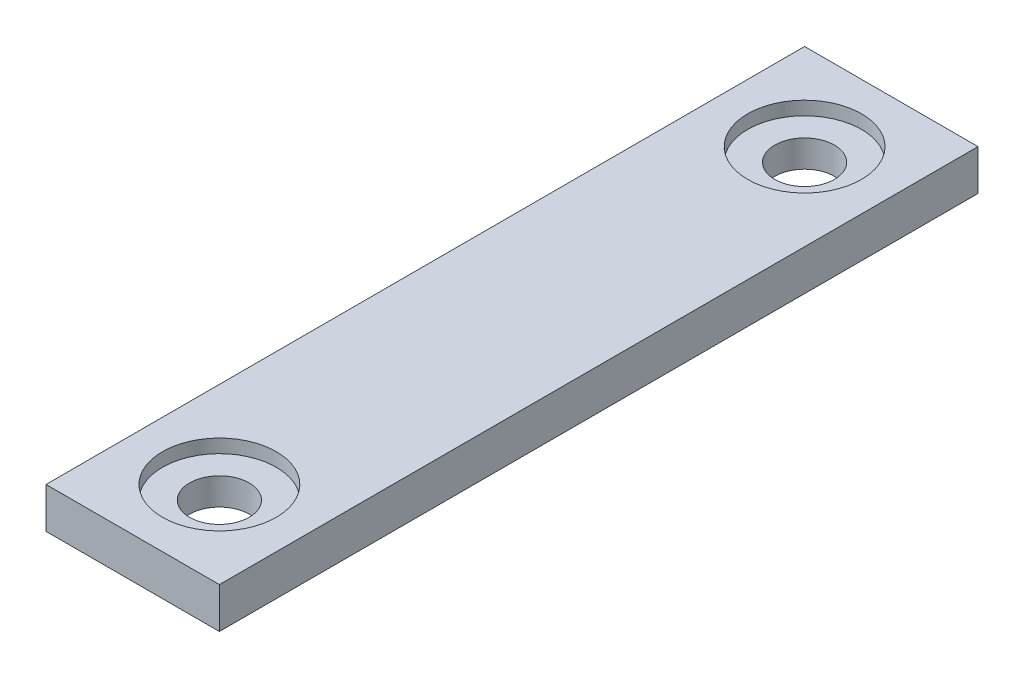
from build123d import *

# Parameters (mm, degrees)
SKETCH_1_W          = 6.4
SKETCH_1_H          = 28
EXTRUDE_1_DEPTH     = 1.5
SKETCH_2_R          = 1.1
CUT_EXTRUDE_1_DEPTH = 15.439182802
SKETCH_3_R          = 2.1
CUT_EXTRUDE_2_DEPTH = 0.5


with BuildPart() as part:
    # Эскиз1 → Бобышка-Вытянуть1 (new body)
    with BuildSketch(Plane(origin=(0, 0, 0), x_dir=(1, 0, 0), z_dir=(0, 1, 0))):
        Rectangle(SKETCH_1_W, SKETCH_1_H)
    extrude(amount=EXTRUDE_1_DEPTH)

    # Эскиз2 → Вырез-Вытянуть1 (cut, through all)
    with BuildSketch(Plane(origin=(0, 1.5, 0), x_dir=(1, 0, 0), z_dir=(0, 1, 0))):
        with Locations(Location((0, 10.8, 0), (0, 0, 270))):
            Circle(SKETCH_2_R)
        with Locations(Location((0, -10.8, 0), (0, 0, 90))):
            Circle(SKETCH_2_R)
    extrude(amount=-CUT_EXTRUDE_1_DEPTH, mode=Mode.SUBTRACT)

    # Эскиз3 → Вырез-Вытянуть2 (cut)
    with BuildSketch(Plane(origin=(0, 1.5, 0), x_dir=(1, 0, 0), z_dir=(0, 1, 0))):
        with Locations(Location((0, 10.8, 0), (0, 0, 270))):
            Circle(SKETCH_3_R)
        with Locations(Location((0, -10.8, 0), (0, 0, 270))):
            Circle(SKETCH_3_R)
    extrude(amount=-CUT_EXTRUDE_2_DEPTH, mode=Mode.SUBTRACT)


solid = part.part
